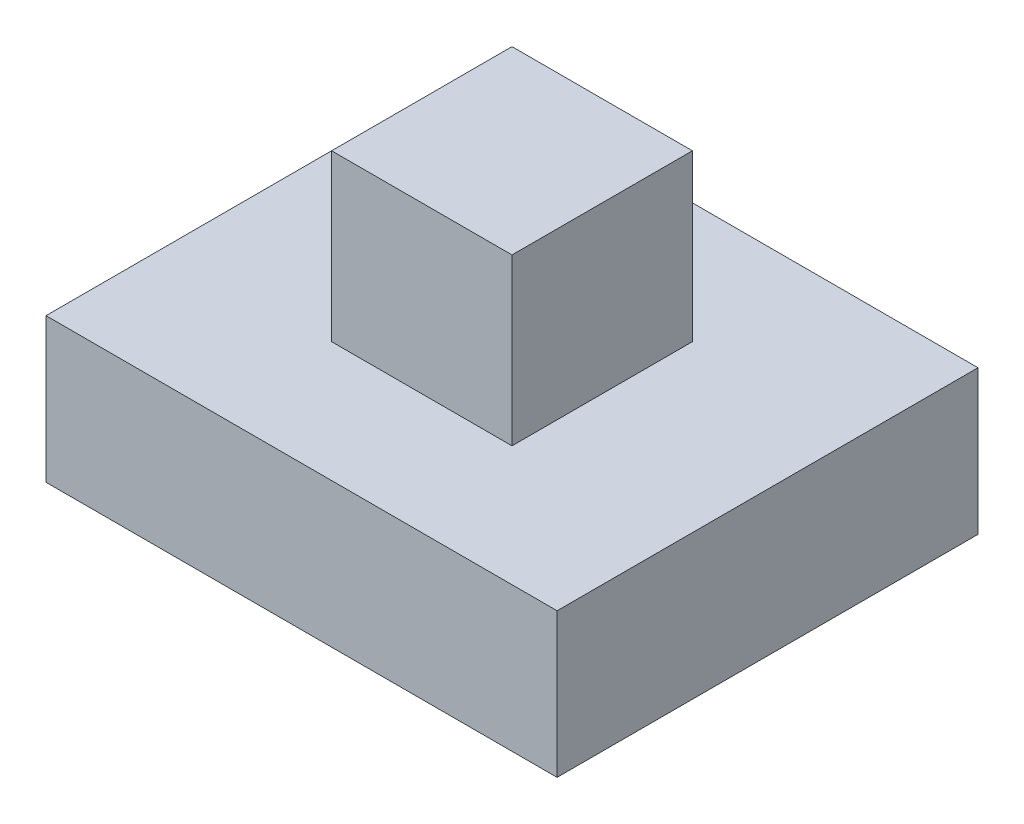
from build123d import *

# Parameters (mm, degrees)
SKETCH1_W           = 17
SKETCH1_H           = 14
BOSS_EXTRUDE1_DEPTH = 4.8
CUT_EXTRUDE1_START  = -4.8
SKETCH1_6_W         = 9
SKETCH1_6_H         = 9
CUT_EXTRUDE1_DEPTH  = 3
SKETCH1_3_W         = 6
SKETCH1_3_H         = 6
BOSS_EXTRUDE2_DEPTH = 5.5


with BuildPart() as part:
    # Sketch1 → Boss-Extrude1 (new body)
    with BuildSketch(Plane(origin=(0, 0, 0), x_dir=(1, 0, 0), z_dir=(0, 1, 0))):
        Rectangle(SKETCH1_W, SKETCH1_H)
    extrude(amount=-BOSS_EXTRUDE1_DEPTH)

    # Sketch1<6> → Cut-Extrude1 (cut)
    with BuildSketch(Plane(origin=(0, 0, 0), x_dir=(1, 0, 0), z_dir=(0, 1, 0)).offset(CUT_EXTRUDE1_START)):
        Rectangle(SKETCH1_6_W, SKETCH1_6_H)
    extrude(amount=CUT_EXTRUDE1_DEPTH, mode=Mode.SUBTRACT)

    # Sketch1<3> → Boss-Extrude2 (add)
    with BuildSketch(Plane(origin=(0, 0, 0), x_dir=(1, 0, 0), z_dir=(0, 1, 0))):
        Rectangle(SKETCH1_3_W, SKETCH1_3_H)
    extrude(amount=BOSS_EXTRUDE2_DEPTH)


solid = part.part
